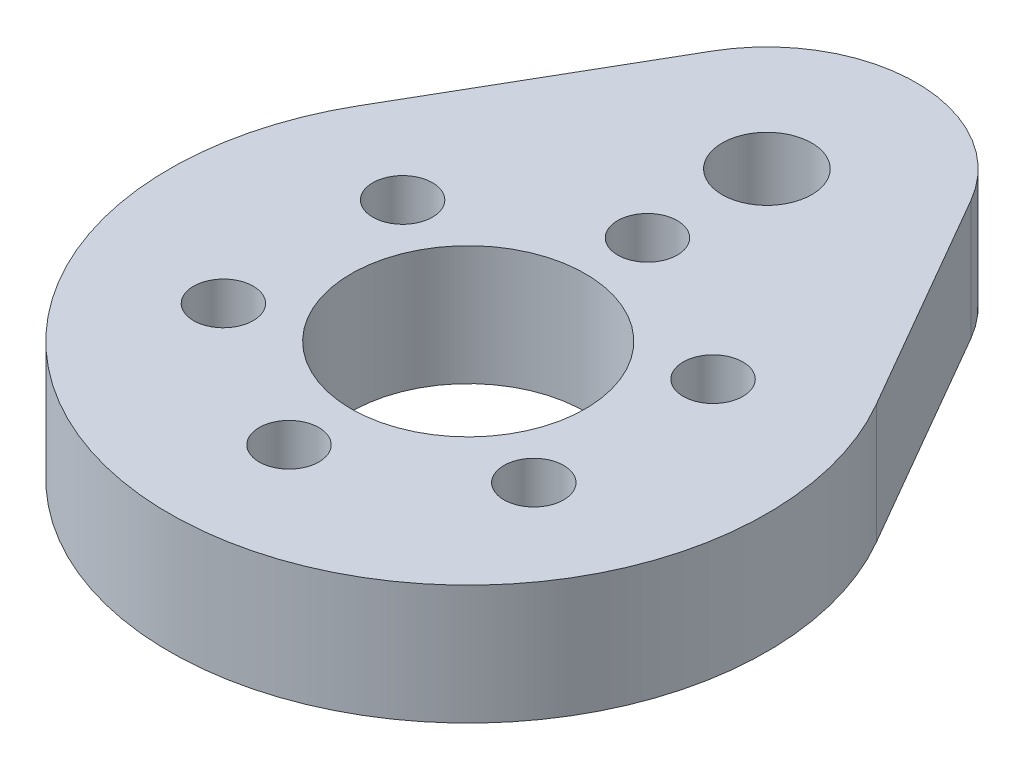
from build123d import *

# Parameters (mm, degrees)
SKETCH1_R           = 4.979156699
SKETCH1_R_2         = 1.27
SKETCH1_R_3         = 1.905
BOSS_EXTRUDE1_DEPTH = 5.08


with BuildPart() as part:
    # Sketch1 → Boss-Extrude1 (new body)
    with BuildSketch(Plane(origin=(0, 0, 0), x_dir=(1, 0, 0), z_dir=(0, 1, 0))):
        with BuildLine():
            Line((-5.499261314, 15.875), (-10.998522628, 6.35))
            ThreePointArc((-10.998522628, 6.35), (0, -12.7), (10.998522628, 6.35))
            Line((10.998522628, 6.35), (5.499261314, 15.875))
            ThreePointArc((5.499261314, 15.875), (0, 19.05), (-5.499261314, 15.875))
        make_face()
        with Locations(Location((0, 0, 0), (0, 0, 270))):
            Circle(SKETCH1_R, mode=Mode.SUBTRACT)
        with Locations(Location((0, 7.62, 0), (0, 0, 270))):
            Circle(SKETCH1_R_2, mode=Mode.SUBTRACT)
        with Locations(Location((6.599113577, 3.81, 0), (0, 0, 270))):
            Circle(SKETCH1_R_2, mode=Mode.SUBTRACT)
        with Locations(Location((6.599113577, -3.81, 0), (0, 0, 270))):
            Circle(SKETCH1_R_2, mode=Mode.SUBTRACT)
        with Locations(Location((0, -7.62, 0), (0, 0, 270))):
            Circle(SKETCH1_R_2, mode=Mode.SUBTRACT)
        with Locations(Location((-6.599113577, -3.81, 0), (0, 0, 270))):
            Circle(SKETCH1_R_2, mode=Mode.SUBTRACT)
        with Locations(Location((-6.599113577, 3.81, 0), (0, 0, 270))):
            Circle(SKETCH1_R_2, mode=Mode.SUBTRACT)
        with Locations(Location((0, 12.7, 0), (0, 0, 270))):
            Circle(SKETCH1_R_3, mode=Mode.SUBTRACT)
    extrude(amount=BOSS_EXTRUDE1_DEPTH)


solid = part.part
